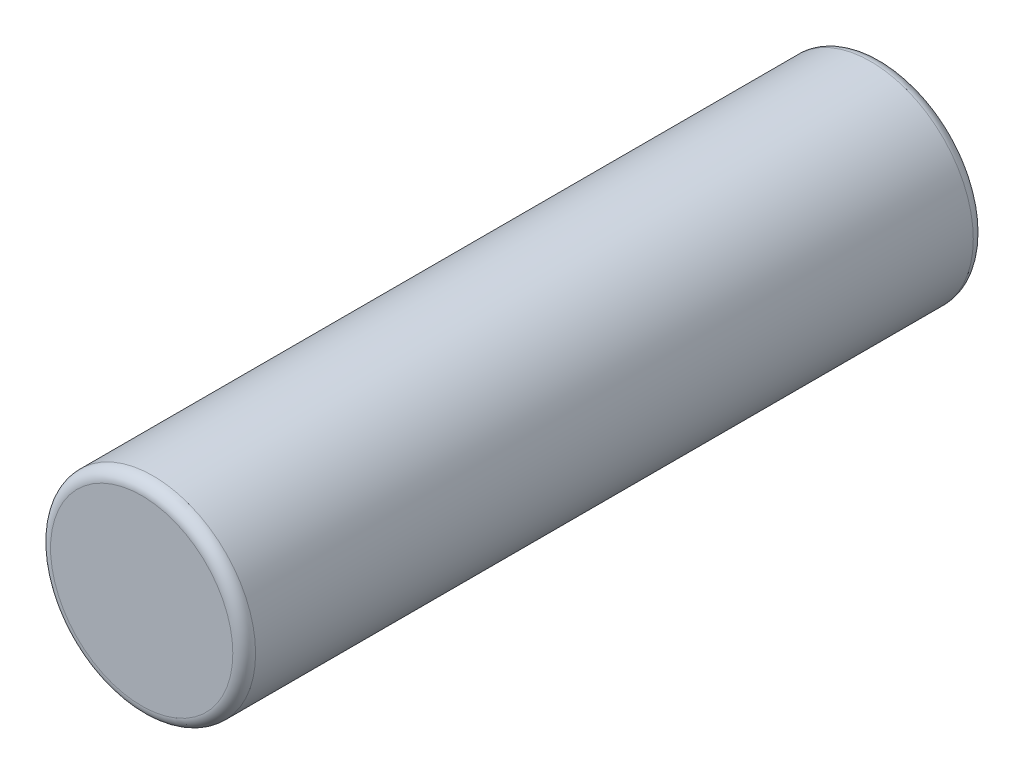
from build123d import *

# Parameters (mm, degrees)
ESQUISSE1_R        = 9
BOSS_EXTRU_1_DEPTH = 32.5
CONG_1_R           = 1


with BuildPart() as part:
    # Esquisse1 → Boss.-Extru.1 (new, symmetric)
    with BuildSketch(Plane.XY):
        Circle(ESQUISSE1_R)
    extrude(amount=BOSS_EXTRU_1_DEPTH, both=True)

    # Congé1
    cong_1_edges = [part.edges().sort_by_distance(p)[0] for p in [
        (-9, 0, -32.5),
        (-9, 0, 32.5),
    ]]
    fillet(cong_1_edges, radius=CONG_1_R)


solid = part.part
